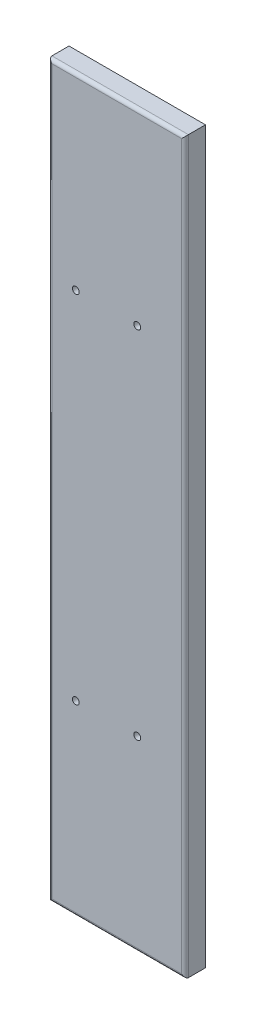
from build123d import *

# Parameters (mm, degrees)
SKETCH1_W                            = 127
SKETCH1_H                            = 679.45
BOSS_EXTRUDE1_DEPTH                  = 19.05
F_1_4_0_25_DIAMETER_HOLE1_AT_2_COUNT = 2
F_1_4_0_25_DIAMETER_HOLE1_AT_2_PITCH = 57.15
F_1_4_0_25_DIAMETER_HOLE1_AT_3_COUNT = 2
F_1_4_0_25_DIAMETER_HOLE1_AT_3_PITCH = 330.911799988
F_1_4_0_25_DIAMETER_HOLE1_AT_4_COUNT = 2
F_1_4_0_25_DIAMETER_HOLE1_AT_4_PITCH = 335.810574388
FILLET1_R                            = 3.175


with BuildPart() as part:
    # Sketch1 → Boss-Extrude1 (new body)
    with BuildSketch(Plane.XY):
        with Locations((9.525, -165.1)):
            Rectangle(SKETCH1_W, SKETCH1_H)
    extrude(amount=BOSS_EXTRUDE1_DEPTH)

    # Sketch4 → 1/4 (0.25) Diameter Hole1 (revolve, cut)
    with BuildSketch(Plane(origin=(-28.575, 0, 19.05), x_dir=(0, -1, 0), z_dir=(1, 0, 0))):
        Polygon((0, 0), (0, 19.05), (3.937, 19.05), (3.175, 18.173419274), (3.175, 0), align=None)
    f_1_4_0_25_diameter_hole1 = revolve(axis=Axis((-28.575, 0, 25.4), (0, 0, -1)), mode=Mode.SUBTRACT)

    # 1/4 (0.25) Diameter Hole1 at 2: 1/4 (0.25) Diameter Hole1 ×2
    with Locations(*[(i * F_1_4_0_25_DIAMETER_HOLE1_AT_2_PITCH, 0, 0) for i in range(1, F_1_4_0_25_DIAMETER_HOLE1_AT_2_COUNT)]):
        add(f_1_4_0_25_diameter_hole1, mode=Mode.SUBTRACT)

    # 1/4 (0.25) Diameter Hole1 at 3: 1/4 (0.25) Diameter Hole1 ×2
    with Locations(*[(0, -i * F_1_4_0_25_DIAMETER_HOLE1_AT_3_PITCH, 0) for i in range(1, F_1_4_0_25_DIAMETER_HOLE1_AT_3_COUNT)]):
        add(f_1_4_0_25_diameter_hole1, mode=Mode.SUBTRACT)

    # 1/4 (0.25) Diameter Hole1 at 4: 1/4 (0.25) Diameter Hole1 ×2
    with Locations(*[Vector(0.1701852304803199, -0.9854120901056372, 0) * (i * F_1_4_0_25_DIAMETER_HOLE1_AT_4_PITCH) for i in range(1, F_1_4_0_25_DIAMETER_HOLE1_AT_4_COUNT)]):
        add(f_1_4_0_25_diameter_hole1, mode=Mode.SUBTRACT)

    # Fillet1
    fillet1_edges = [part.edges().sort_by_distance(p)[0] for p in [
        (9.525, -504.825, 19.05),
        (-53.975, -165.1, 19.05),
        (9.525, 174.625, 19.05),
        (73.025, -165.1, 19.05),
    ]]
    fillet(fillet1_edges, radius=FILLET1_R)


solid = part.part
